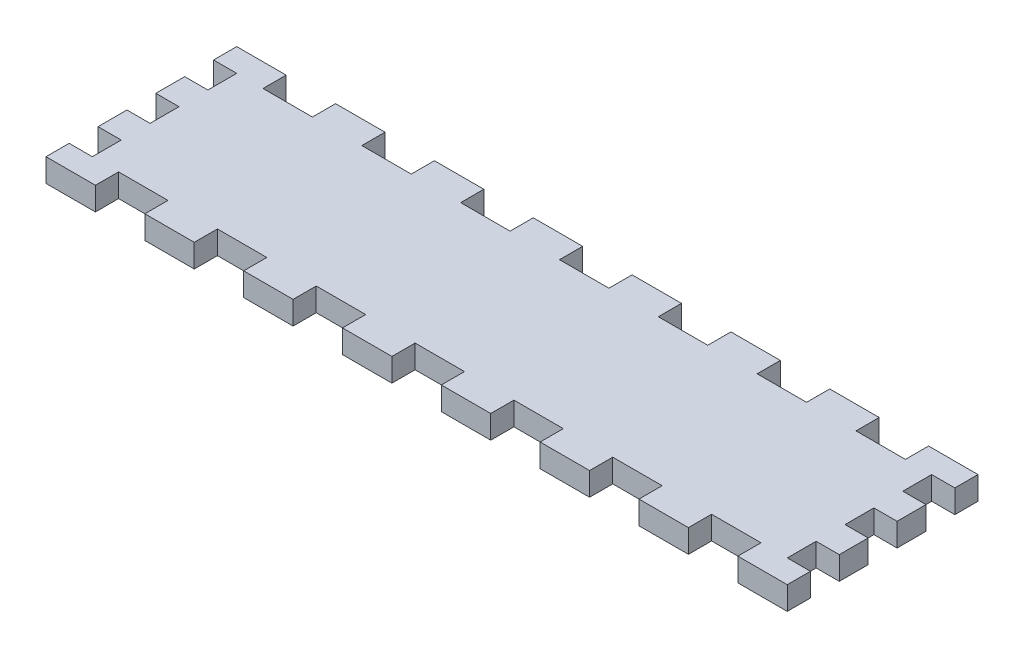
from build123d import *

# Parameters (mm, degrees)
BOSS_EXTRUDE1_DEPTH = 6.35


with BuildPart() as part:
    # Sketch1 → Boss-Extrude1 (new body)
    with BuildSketch(Plane(origin=(0, 0, 0), x_dir=(1, 0, 0), z_dir=(0, 1, 0))):
        Polygon((-61.90815559, -12.656485902), (-61.90815559, -20.574064123), (-55.558156531, -20.574064123), (-55.558156531, -28.491642345), (-61.90815559, -28.491642345), (-61.90815559, -34.841642345), (-48.361489394, -34.841642345), (-48.361489394, -28.491642345), (-34.814823197, -28.491642345), (-34.814823197, -34.841642345), (-21.268659618, -34.841642345), (-21.268659618, -28.491642345), (-7.722496038, -28.491642345), (-7.722496038, -34.841642345), (5.823667541, -34.841642345), (5.823667541, -28.491642345), (19.36983112, -28.491642345), (19.36983112, -34.841642345), (32.9159947, -34.841642345), (32.9159947, -28.491642345), (46.462158279, -28.491642345), (46.462158279, -34.841642345), (60.008321858, -34.841642345), (60.008321858, -28.491642345), (73.554485438, -28.491642345), (73.554485438, -34.841642345), (87.100649017, -34.841642345), (87.100649017, -28.491642345), (100.646812596, -28.491642345), (100.646812596, -34.841642345), (114.195155744, -34.841642345), (114.195155744, -28.491642345), (127.743498891, -28.491642345), (127.743498891, -34.841642345), (141.291842039, -34.841642345), (141.291842039, -28.491642345), (134.941843469, -28.491642345), (134.941843469, -20.574064123), (141.291842039, -20.574064123), (141.291842039, -12.656485902), (134.941843469, -12.656485902), (134.941843469, -4.738907681), (141.291842039, -4.738907681), (141.291842039, 3.17867054), (134.941843469, 3.17867054), (134.941843469, 11.096248761), (141.291842039, 11.096248761), (141.291842039, 17.446248761), (127.745179954, 17.446248761), (127.745179954, 11.096248761), (114.198517869, 11.096248761), (114.198517869, 17.446248761), (100.651855784, 17.446248761), (100.651855784, 11.096248761), (87.105186193, 11.096248761), (87.105186193, 17.446248761), (73.558516602, 17.446248761), (73.558516602, 11.096248761), (60.011847011, 11.096248761), (60.011847011, 17.446248761), (46.465177419, 17.446248761), (46.465177419, 11.096248761), (32.918507828, 11.096248761), (32.918507828, 17.446248761), (19.371838237, 17.446248761), (19.371838237, 11.096248761), (5.825168646, 11.096248761), (5.825168646, 17.446248761), (-7.721500945, 17.446248761), (-7.721500945, 11.096248761), (-21.268170536, 11.096248761), (-21.268170536, 17.446248761), (-34.814840128, 17.446248761), (-34.814840128, 11.096248761), (-48.361497859, 11.096248761), (-48.361497859, 17.446248761), (-61.90815559, 17.446248761), (-61.90815559, 11.096248761), (-55.558156531, 11.096248761), (-55.558156531, 3.17867054), (-61.90815559, 3.17867054), (-61.90815559, -4.738907681), (-55.558156531, -4.738907681), (-55.558156531, -12.656485902), align=None)
    extrude(amount=BOSS_EXTRUDE1_DEPTH)


solid = part.part
